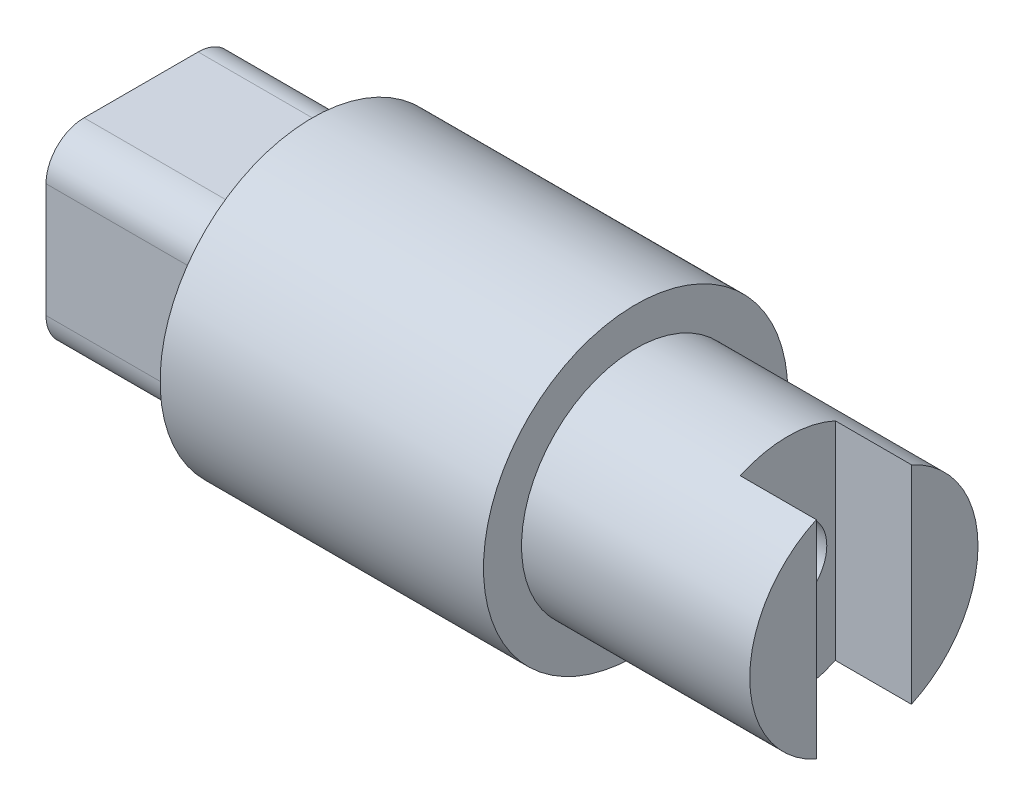
from build123d import *

# Parameters (mm, degrees)
SKETCH1_W                    = 8.5
SKETCH1_H                    = 4
SKETCH2_W                    = 5
SKETCH2_H                    = 5
BOSS_EXTRUDE1_DEPTH          = 4.5
SKETCH3_R                    = 3
BOSS_EXTRUDE2_DEPTH          = 6
SKETCH8_W                    = 2.5
SKETCH8_H                    = 6.839743052
CUT_EXTRUDE2_DEPTH           = 2
FILLET1_R                    = 1
M3X0_5_TAPPED_HOLE1_D        = 2.5
M3X0_5_TAPPED_HOLE1_DEPTH    = 7.5
M3X0_5_TAPPED_HOLE1_TIP      = 0.751075774
M2_5X0_45_TAPPED_HOLE2_D     = 2.05
M2_5X0_45_TAPPED_HOLE2_DEPTH = 5
M2_5X0_45_TAPPED_HOLE2_TIP   = 0.615882135


with BuildPart() as part:
    # Sketch1 → Revolve1 (revolve)
    with BuildSketch(Plane.XY, mode=Mode.PRIVATE) as revolve1_sk:
        with Locations((9.25, 2)):
            Rectangle(SKETCH1_W, SKETCH1_H)
    revolve(revolve1_sk.sketch.rotate(Axis((5, 0, 0), (1, 0, 0)), 270), axis=Axis((5, 0, 0), (1, 0, 0)))

    # Sketch2 → Boss-Extrude1 (add)
    with BuildSketch(Plane.ZY.offset(-5)):
        Rectangle(SKETCH2_W, SKETCH2_H)
    extrude(amount=BOSS_EXTRUDE1_DEPTH)

    # Sketch3 → Boss-Extrude2 (add)
    with BuildSketch(Plane(origin=(13.5, 0, 0), x_dir=(0, 0, -1), z_dir=(1, 0, 0))):
        Circle(SKETCH3_R)
    extrude(amount=BOSS_EXTRUDE2_DEPTH)

    # Sketch8 → Cut-Extrude2 (cut)
    with BuildSketch(Plane(origin=(19.5, 0, 0), x_dir=(0, 0, -1), z_dir=(1, 0, 0))):
        Rectangle(SKETCH8_W, SKETCH8_H)
    extrude(amount=-CUT_EXTRUDE2_DEPTH, mode=Mode.SUBTRACT)

    # Fillet1
    fillet1_edges = [part.edges().sort_by_distance(p)[0] for p in [
        (2.75, -2.5, 2.5),
        (2.75, 2.5, 2.5),
        (2.75, 2.5, -2.5),
        (2.75, -2.5, -2.5),
    ]]
    fillet(fillet1_edges, radius=FILLET1_R)

    # M3x0.5 Tapped Hole1
    with Locations(Plane(origin=(0.5, 0, 0), x_dir=(0, 0, -1), z_dir=(-1, 0, 0))):
        with Locations((0, 0)):
            Hole(M3X0_5_TAPPED_HOLE1_D / 2, depth=M3X0_5_TAPPED_HOLE1_DEPTH)
            with Locations((0, 0, -(M3X0_5_TAPPED_HOLE1_DEPTH + M3X0_5_TAPPED_HOLE1_TIP / 2))):  # 118° drill point
                Cone(0, M3X0_5_TAPPED_HOLE1_D / 2, M3X0_5_TAPPED_HOLE1_TIP, mode=Mode.SUBTRACT)

    # M2.5x0.45 Tapped Hole2
    with Locations(Plane(origin=(17.5, 0, 0), x_dir=(0, 0, 1), z_dir=(1, 0, 0))):
        with Locations((0, 0)):
            Hole(M2_5X0_45_TAPPED_HOLE2_D / 2, depth=M2_5X0_45_TAPPED_HOLE2_DEPTH)
            with Locations((0, 0, -(M2_5X0_45_TAPPED_HOLE2_DEPTH + M2_5X0_45_TAPPED_HOLE2_TIP / 2))):  # 118° drill point
                Cone(0, M2_5X0_45_TAPPED_HOLE2_D / 2, M2_5X0_45_TAPPED_HOLE2_TIP, mode=Mode.SUBTRACT)


solid = part.part
